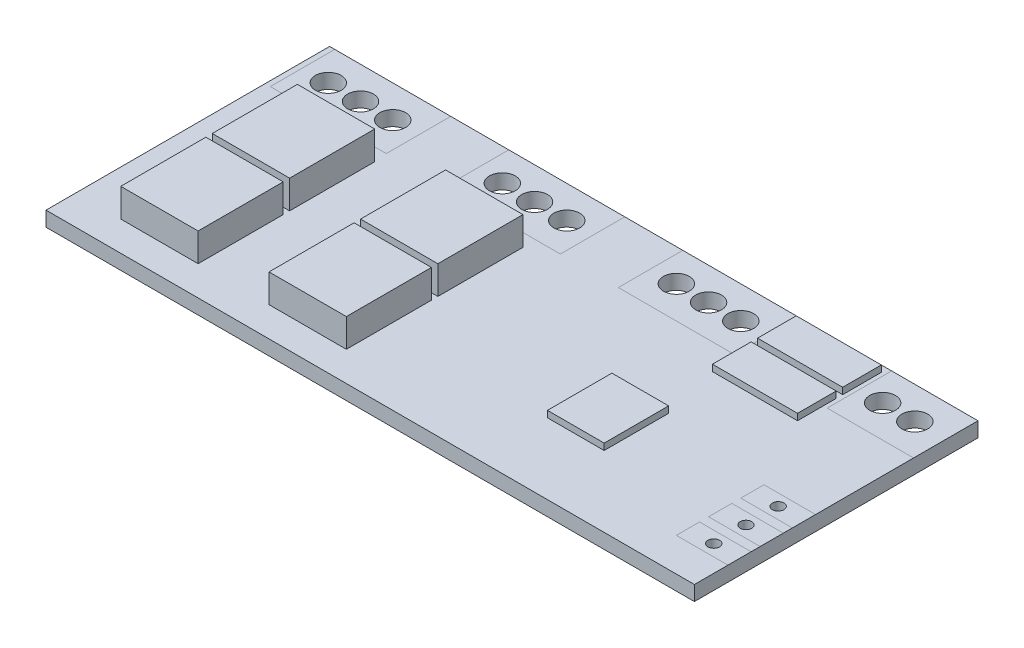
from build123d import *

# Parameters (mm, degrees)
CROQUIS1_W                = 50.3
CROQUIS1_H                = 22
CROQUIS1_R                = 0.45
CROQUIS1_R_2              = 1
SALIENTE_EXTRUIR1_DEPTH   = 1.15
CROQUIS2_W                = 6
CROQUIS2_H                = 6.6
SALIENTE_EXTRUIR2_DEPTH   = 2.2
SALIENTE_EXTRUIR2_2_DEPTH = 2.2
SALIENTE_EXTRUIR2_3_DEPTH = 2.2
SALIENTE_EXTRUIR2_4_DEPTH = 2.2
CROQUIS3_W                = 4.4
CROQUIS3_H                = 5
SALIENTE_EXTRUIR3_DEPTH   = 0.5
CROQUIS3_W_2              = 6.6
CROQUIS3_H_2              = 3
SALIENTE_EXTRUIR3_2_DEPTH = 0.5
SALIENTE_EXTRUIR3_3_DEPTH = 0.5


with BuildPart() as part:
    # Croquis1 → Saliente-Extruir1 (new body)
    with BuildSketch(Plane(origin=(0, 0, 0), x_dir=(1, 0, 0), z_dir=(0, 1, 0))):
        Rectangle(CROQUIS1_W, CROQUIS1_H)
        with Locations(Location((23.15, -7.5, 0), (0, 0, 270))):
            Circle(CROQUIS1_R, mode=Mode.SUBTRACT)
        with Locations(Location((23.15, -5, 0), (0, 0, 270))):
            Circle(CROQUIS1_R, mode=Mode.SUBTRACT)
        with Locations(Location((23.15, -2.5, 0), (0, 0, 270))):
            Circle(CROQUIS1_R, mode=Mode.SUBTRACT)
        with Locations(Location((4.25, 8.5, 0), (0, 0, 270))):
            Circle(CROQUIS1_R_2, mode=Mode.SUBTRACT)
        with Locations(Location((6.75, 8.5, 0), (0, 0, 270))):
            Circle(CROQUIS1_R_2, mode=Mode.SUBTRACT)
        with Locations(Location((9.25, 8.5, 0), (0, 0, 270))):
            Circle(CROQUIS1_R_2, mode=Mode.SUBTRACT)
        with Locations(Location((-9.25, 8.5, 0), (0, 0, 90))):
            Circle(CROQUIS1_R_2, mode=Mode.SUBTRACT)
        with Locations(Location((-6.75, 8.5, 0), (0, 0, 90))):
            Circle(CROQUIS1_R_2, mode=Mode.SUBTRACT)
        with Locations(Location((-4.25, 8.5, 0), (0, 0, 90))):
            Circle(CROQUIS1_R_2, mode=Mode.SUBTRACT)
        with Locations(Location((-22.75, 8.5, 0), (0, 0, 270))):
            Circle(CROQUIS1_R_2, mode=Mode.SUBTRACT)
        with Locations(Location((-20.25, 8.5, 0), (0, 0, 270))):
            Circle(CROQUIS1_R_2, mode=Mode.SUBTRACT)
        with Locations(Location((-17.75, 8.5, 0), (0, 0, 270))):
            Circle(CROQUIS1_R_2, mode=Mode.SUBTRACT)
        with Locations(Location((22.75, 8.5, 0), (0, 0, 90))):
            Circle(CROQUIS1_R_2, mode=Mode.SUBTRACT)
        with Locations(Location((20.25, 8.5, 0), (0, 0, 90))):
            Circle(CROQUIS1_R_2, mode=Mode.SUBTRACT)
    extrude(amount=SALIENTE_EXTRUIR1_DEPTH)


with BuildPart() as body_2:
    # Croquis2 → Saliente-Extruir2 (new body)
    with BuildSketch(Plane(origin=(0, 1.15, 0), x_dir=(1, 0, 0), z_dir=(0, 1, 0))):
        with Locations((-18.65, 1.7)):
            Rectangle(CROQUIS2_W, CROQUIS2_H)
    extrude(amount=SALIENTE_EXTRUIR2_DEPTH)


with BuildPart() as body_3:
    # Croquis2 → Saliente-Extruir2 2 (new body)
    with BuildSketch(Plane(origin=(0, 1.15, 0), x_dir=(1, 0, 0), z_dir=(0, 1, 0))):
        with Locations((-7.15, 1.7)):
            Rectangle(CROQUIS2_W, CROQUIS2_H)
    extrude(amount=SALIENTE_EXTRUIR2_2_DEPTH)


with BuildPart() as body_4:
    # Croquis2 → Saliente-Extruir2 3 (new body)
    with BuildSketch(Plane(origin=(0, 1.15, 0), x_dir=(1, 0, 0), z_dir=(0, 1, 0))):
        with Locations((-7.15, -5.4)):
            Rectangle(CROQUIS2_W, CROQUIS2_H)
    extrude(amount=SALIENTE_EXTRUIR2_3_DEPTH)


with BuildPart() as body_5:
    # Croquis2 → Saliente-Extruir2 4 (new body)
    with BuildSketch(Plane(origin=(0, 1.15, 0), x_dir=(1, 0, 0), z_dir=(0, 1, 0))):
        with Locations((-18.65, -5.4)):
            Rectangle(CROQUIS2_W, CROQUIS2_H)
    extrude(amount=SALIENTE_EXTRUIR2_4_DEPTH)


with BuildPart() as body_6:
    # Croquis3 → Saliente-Extruir3 (new body)
    with BuildSketch(Plane(origin=(0, 1.15, 0), x_dir=(1, 0, 0), z_dir=(0, 1, 0))):
        with Locations((10.45, -3)):
            Rectangle(CROQUIS3_W, CROQUIS3_H)
    extrude(amount=SALIENTE_EXTRUIR3_DEPTH)


with BuildPart() as body_7:
    # Croquis3 → Saliente-Extruir3 2 (new body)
    with BuildSketch(Plane(origin=(0, 1.15, 0), x_dir=(1, 0, 0), z_dir=(0, 1, 0))):
        with Locations((14.85, 9)):
            Rectangle(CROQUIS3_W_2, CROQUIS3_H_2)
    extrude(amount=SALIENTE_EXTRUIR3_2_DEPTH)


with BuildPart() as body_8:
    # Croquis3 → Saliente-Extruir3 3 (new body)
    with BuildSketch(Plane(origin=(0, 1.15, 0), x_dir=(1, 0, 0), z_dir=(0, 1, 0))):
        with Locations((14.85, 5.5)):
            Rectangle(CROQUIS3_W_2, CROQUIS3_H_2)
    extrude(amount=SALIENTE_EXTRUIR3_3_DEPTH)


solid = Compound([part.part, body_2.part, body_3.part, body_4.part, body_5.part, body_6.part, body_7.part, body_8.part])
